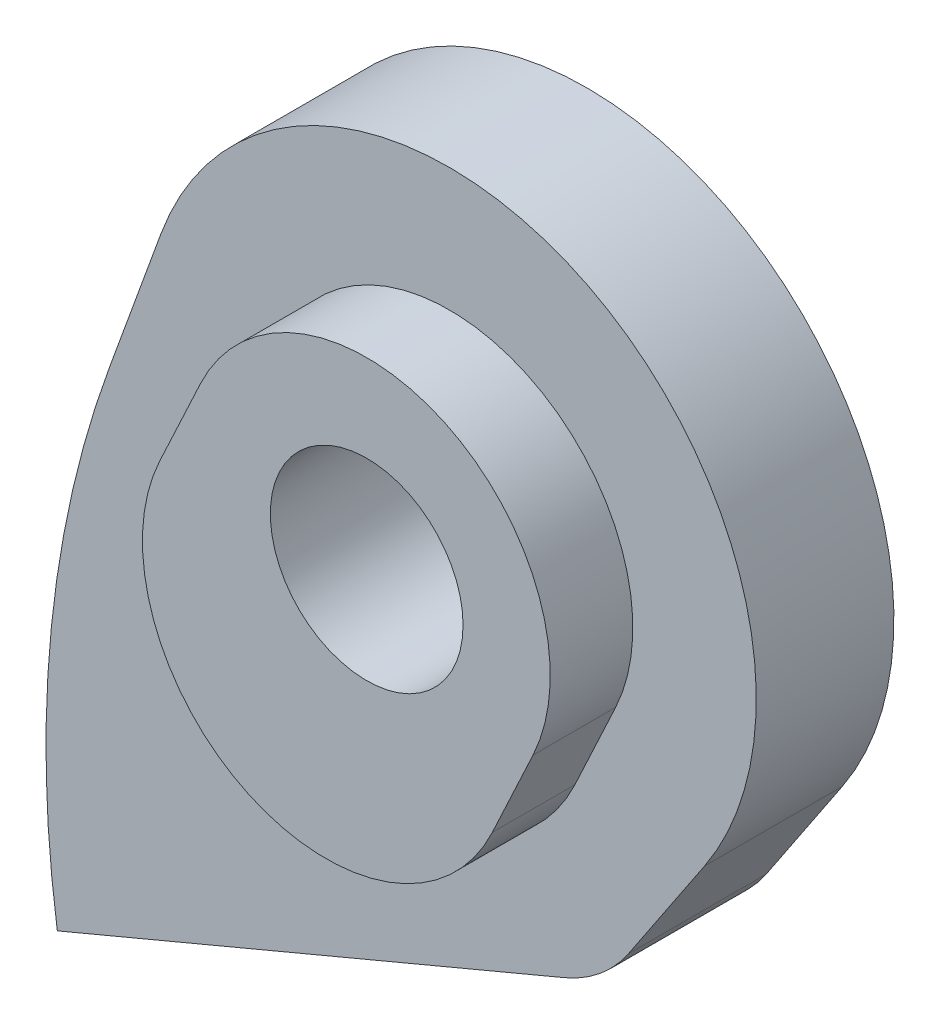
from build123d import *
from build123d.topology import SkipClean

# Parameters (mm, degrees)
SKETCH3_R           = 2.75
SKETCH3_R_2         = 2.1
BOSS_EXTRUDE2_DEPTH = 11
BOSS_EXTRUDE4_START = 3
BOSS_EXTRUDE4_DEPTH = 3
BOSS_EXTRUDE3_START = 3
BOSS_EXTRUDE3_DEPTH = 3
SKETCH14_W          = 47.285712055
SKETCH14_H          = 12.595473758
CUT_EXTRUDE1_DEPTH  = 92.326119258
BOSS_EXTRUDE5_DEPTH = 1.8
SKETCH15_R          = 2.1
CUT_EXTRUDE2_DEPTH  = 88.602742559


with BuildPart() as part:
    # Sketch3 → Boss-Extrude2 (new body)
    with BuildSketch(Plane.XY):
        with BuildLine():
            Line((11.81639044, 60.252883085), (11.728372068, 60.311638564))
            ThreePointArc((11.728372068, 60.311638564), (8.917204522, 62.7925154), (6.866230988, 65.931132995))
            ThreePointArc((6.866230988, 65.931132995), (6.025591445, 67.274340702), (4.901176311, 68.390840765))
            ThreePointArc((4.901176311, 68.390840765), (3.375934297, 70.989881123), (4.020351516, 73.93370524))
            Line((4.020351516, 73.93370524), (5.678869184, 76.41823992))
            ThreePointArc((5.678869184, 76.41823992), (3.137547336, 86.100651278), (-6.171856019, 82.420649156))
            Line((-6.171856019, 82.420649156), (-7.290261888, 79.347854286))
            ThreePointArc((-7.290261888, 79.347854286), (-8.557893098, 69.185727028), (-5.279809822, 59.483671095))
            ThreePointArc((-5.279809822, 59.483671095), (-2.848156457, 57.139360441), (0.414833066, 56.266646336))
            ThreePointArc((0.414833066, 56.266646336), (3.287818882, 55.822166382), (5.91364728, 54.574514525))
            Line((5.91364728, 54.574514525), (7.374782695, 53.599153256))
            ThreePointArc((7.374782695, 53.599153256), (10.815902262, 50.678650143), (13.499590609, 47.049812979))
            ThreePointArc((13.499590609, 47.049812979), (24.965953819, 46.665736496), (20.21385057, 57.108078892))
            ThreePointArc((20.21385057, 57.108078892), (15.833272198, 58.194897845), (11.81639044, 60.252883085))
        make_face()
        with Locations((19.351869275, 50.413343031)):
            Circle(SKETCH3_R, mode=Mode.SUBTRACT)
        with Locations((0.471910886, 63.016405008)):
            Circle(SKETCH3_R, mode=Mode.SUBTRACT)
        with Locations((0.114687614, 80.132534397)):
            Circle(SKETCH3_R_2, mode=Mode.SUBTRACT)
    extrude(amount=BOSS_EXTRUDE2_DEPTH)

    # Sketch13 → Boss-Extrude4 (add)
    with SkipClean():  # the faces are left unmerged after this step: merging them gives an invalid solid
        with BuildSketch(Plane(origin=(0, 0, 0), x_dir=(-1, 0, 0), z_dir=(0, 0, -1)).offset(BOSS_EXTRUDE4_START)):
            with BuildLine():
                Line((-5.678869184, 76.41823992), (-4.020351516, 73.93370524))
                ThreePointArc((-4.020351516, 73.93370524), (-3.407782277, 73.255690271), (-2.625844204, 72.782913134))
                Line((-2.625844204, 72.782913134), (8.427696777, 68.139691908))
                ThreePointArc((8.427696777, 68.139691908), (8.557268078, 73.814637343), (7.290261888, 79.347854286))
                Line((7.290261888, 79.347854286), (6.171856019, 82.420649156))
                ThreePointArc((6.171856019, 82.420649156), (-3.137547336, 86.100651278), (-5.678869184, 76.41823992))
            make_face()
        extrude(amount=-BOSS_EXTRUDE4_DEPTH)

    # Sketch12 → Boss-Extrude3 (add)
    with SkipClean():  # the faces are left unmerged after this step: merging them gives an invalid solid
        with BuildSketch(Plane(origin=(0, 0, -3), x_dir=(-1, 0, 0), z_dir=(0, 0, -1)).offset(BOSS_EXTRUDE3_START)):
            with BuildLine():
                Line((8.013597957, 76.965805827), (4.924247842, 69.611373108))
                Line((4.924247842, 69.611373108), (8.427696777, 68.139691908))
                ThreePointArc((8.427696777, 68.139691908), (8.649339764, 72.572862025), (8.013597957, 76.965805827))
            make_face()
        extrude(amount=-BOSS_EXTRUDE3_DEPTH)

    # Sketch14 → Cut-Extrude1 (cut, through all)
    with BuildSketch(Plane(origin=(0, 0, 0), x_dir=(1, 0, 0), z_dir=(0, 1, 0))):
        with Locations((8.412006537, -6.297736879)):
            Rectangle(SKETCH14_W, SKETCH14_H)
    extrude(amount=CUT_EXTRUDE1_DEPTH, mode=Mode.SUBTRACT)

    # Sketch16 → Boss-Extrude5 (add)
    with BuildSketch(Plane.XY):
        with BuildLine():
            Line((3.739918762, 78.44206135), (2.852420412, 76.538814997))
            ThreePointArc((2.852420412, 76.538814997), (-2.463283783, 74.604056896), (-4.398041884, 79.919761091))
            Line((-4.398041884, 79.919761091), (-3.510543534, 81.823007444))
            ThreePointArc((-3.510543534, 81.823007444), (1.805160661, 83.757765545), (3.739918762, 78.44206135))
        make_face()
    extrude(amount=BOSS_EXTRUDE5_DEPTH)

    # Sketch15 → Cut-Extrude2 (cut, through all)
    with BuildSketch(Plane.XY.offset(1.8)):
        with Locations((0.114687614, 80.132534397)):
            Circle(SKETCH15_R)
    extrude(amount=-CUT_EXTRUDE2_DEPTH, mode=Mode.SUBTRACT)


solid = part.part
